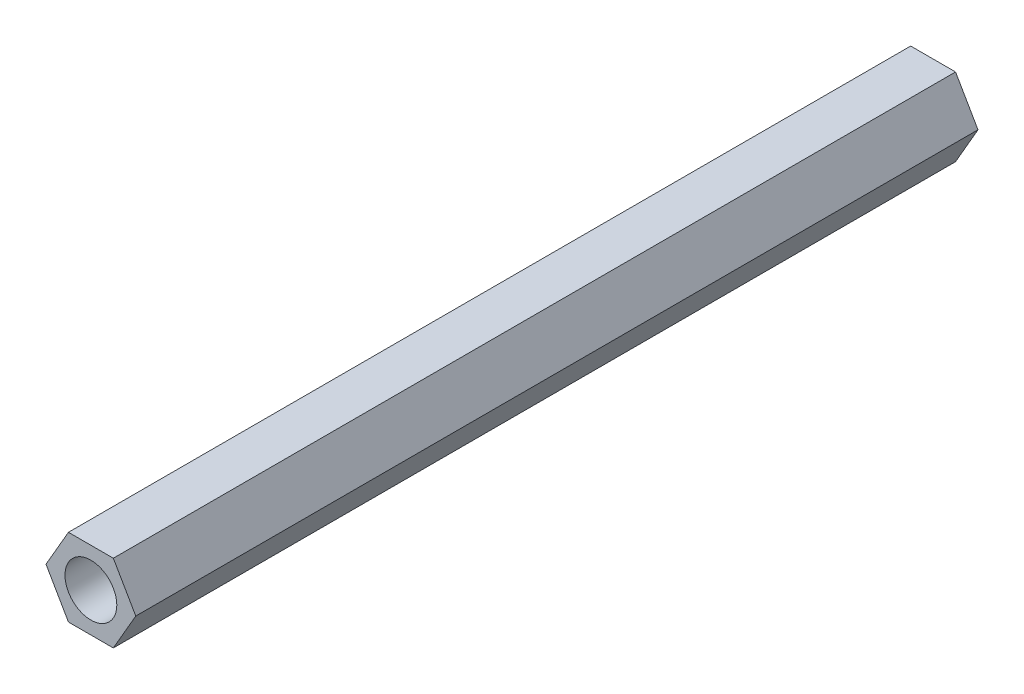
from build123d import *

# Parameters (mm, degrees)
ESQUISSE1_R        = 2
BOSS_EXTRU_1_DEPTH = 65


with BuildPart() as part:
    # Esquisse1 → Boss.-Extru.1 (new body)
    with BuildSketch(Plane.XY):
        Polygon((-3.464101615, 0), (-1.732050808, -3), (1.732050808, -3), (3.464101615, 0), (1.732050808, 3), (-1.732050808, 3), align=None)
        Circle(ESQUISSE1_R, mode=Mode.SUBTRACT)
    extrude(amount=BOSS_EXTRU_1_DEPTH)


solid = part.part
